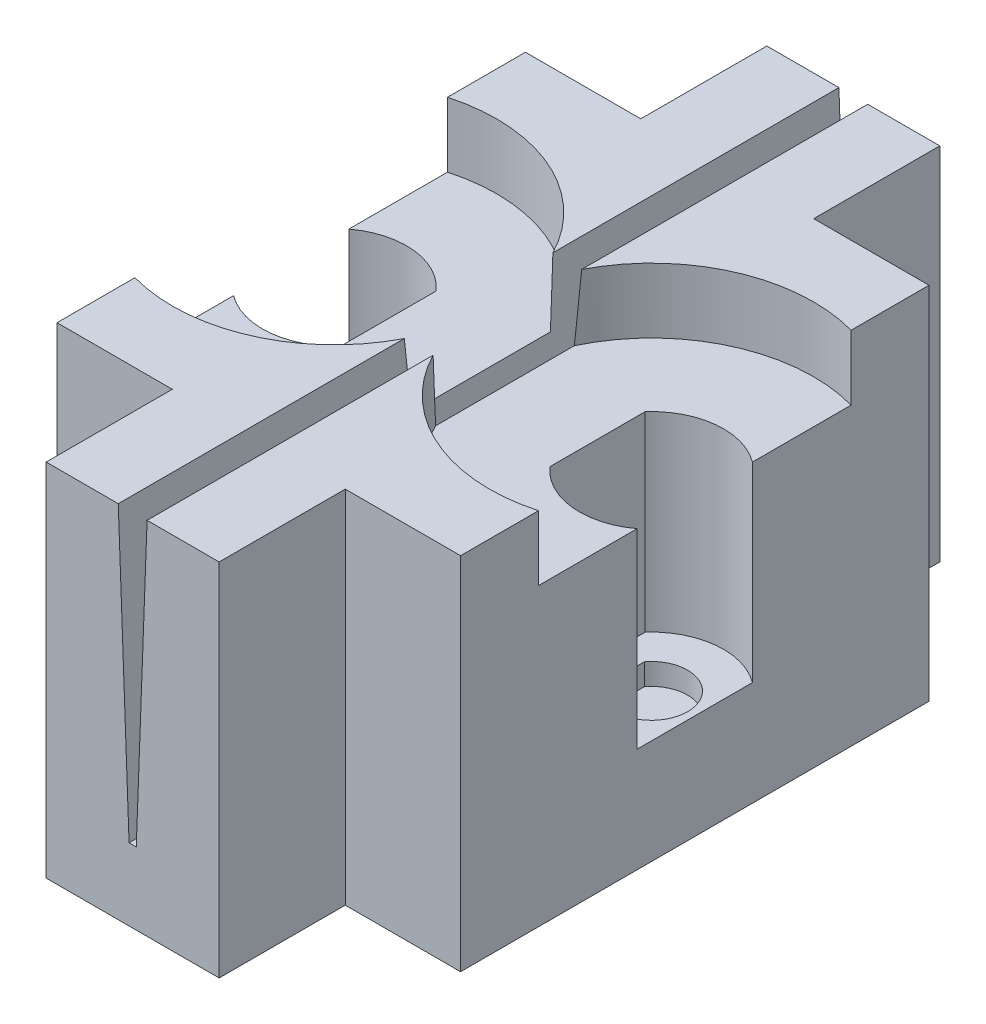
from build123d import *

# Parameters (mm, degrees)
SKETCH1_W           = 56
SKETCH1_H           = 100
BOSS_EXTRUDE1_DEPTH = 50
CUT_EXTRUDE2_DEPTH  = 116.256236274
SKETCH7_R           = 22.5
SKETCH7_R_2         = 10
CUT_EXTRUDE4_DEPTH  = 9
CUT_EXTRUDE5_DEPTH  = 35.5
CUT_EXTRUDE6_DEPTH  = 3
CUT_EXTRUDE7_DEPTH  = 9
SKETCH12_W          = 16
SKETCH12_H          = 17.5
CUT_EXTRUDE8_DEPTH  = 77.052613367


with BuildPart() as part:
    # Sketch1 → Boss-Extrude1 (new body)
    with BuildSketch(Plane(origin=(0, 0, 0), x_dir=(1, 0, 0), z_dir=(0, 1, 0))):
        Rectangle(SKETCH1_W, SKETCH1_H)
    extrude(amount=BOSS_EXTRUDE1_DEPTH)

    # Sketch3 → Cut-Extrude2 (cut, through all)
    with BuildSketch(Plane.XY.offset(50)):
        Polygon((-0.5, 10), (-2, 50), (2, 50), (0.5, 10), align=None)
    extrude(amount=-CUT_EXTRUDE2_DEPTH, mode=Mode.SUBTRACT)

    # Sketch7 → Cut-Extrude4 (cut)
    with BuildSketch(Plane(origin=(0, 50, 0), x_dir=(1, 0, 0), z_dir=(0, 1, 0))):
        with Locations((22, 0)):
            Circle(SKETCH7_R)
        with Locations((22, 0)):
            Circle(SKETCH7_R_2, mode=Mode.SUBTRACT)
    cut_extrude4 = extrude(amount=-CUT_EXTRUDE4_DEPTH, mode=Mode.SUBTRACT)

    # Sketch9 → Cut-Extrude5 (cut)
    with BuildSketch(Plane(origin=(0, 50, 0), x_dir=(1, 0, 0), z_dir=(0, 1, 0))):
        with BuildLine():
            Line((14.5, 6.614378278), (14.5, -6.614378278))
            ThreePointArc((14.5, -6.614378278), (32, 0), (14.5, 6.614378278))
        make_face()
    cut_extrude5 = extrude(amount=-CUT_EXTRUDE5_DEPTH, mode=Mode.SUBTRACT)

    # Sketch10 → Cut-Extrude6 (cut)
    with BuildSketch(Plane(origin=(0, 14.5, 0), x_dir=(1, 0, 0), z_dir=(0, 1, 0))):
        with BuildLine():
            Line((18, 3), (18, -3))
            ThreePointArc((18, -3), (27, 0), (18, 3))
        make_face()
    cut_extrude6 = extrude(amount=-CUT_EXTRUDE6_DEPTH, mode=Mode.SUBTRACT)

    # Sketch11 → Cut-Extrude7 (cut)
    with BuildSketch(Plane(origin=(0, 50, 0), x_dir=(1, 0, 0), z_dir=(0, 1, 0))):
        with BuildLine():
            Line((14.5, 6.614378278), (14.5, -6.614378278))
            ThreePointArc((14.5, -6.614378278), (12, 0), (14.5, 6.614378278))
        make_face()
    cut_extrude7 = extrude(amount=-CUT_EXTRUDE7_DEPTH, mode=Mode.SUBTRACT)

    # Mirror1: Cut-Extrude4, Cut-Extrude5, Cut-Extrude6, Cut-Extrude7 across plane
    add(cut_extrude4.mirror(Plane(origin=(0, 0, 0), x_dir=(0, 0, 1), z_dir=(1, 0, 0))), mode=Mode.SUBTRACT)
    add(cut_extrude5.mirror(Plane(origin=(0, 0, 0), x_dir=(0, 0, 1), z_dir=(1, 0, 0))), mode=Mode.SUBTRACT)
    add(cut_extrude6.mirror(Plane(origin=(0, 0, 0), x_dir=(0, 0, 1), z_dir=(1, 0, 0))), mode=Mode.SUBTRACT)
    add(cut_extrude7.mirror(Plane(origin=(0, 0, 0), x_dir=(0, 0, 1), z_dir=(1, 0, 0))), mode=Mode.SUBTRACT)

    # Sketch12 → Cut-Extrude8 (cut, through all)
    with BuildSketch(Plane(origin=(0, 50, 0), x_dir=(1, 0, 0), z_dir=(0, 1, 0))):
        with Locations((-20, 41.25)):
            Rectangle(SKETCH12_W, SKETCH12_H)
        with Locations((20, 41.25)):
            Rectangle(SKETCH12_W, SKETCH12_H)
        with Locations((-20, -41.25)):
            Rectangle(SKETCH12_W, SKETCH12_H)
        with Locations((20, -41.25)):
            Rectangle(SKETCH12_W, SKETCH12_H)
    extrude(amount=-CUT_EXTRUDE8_DEPTH, mode=Mode.SUBTRACT)


solid = part.part
